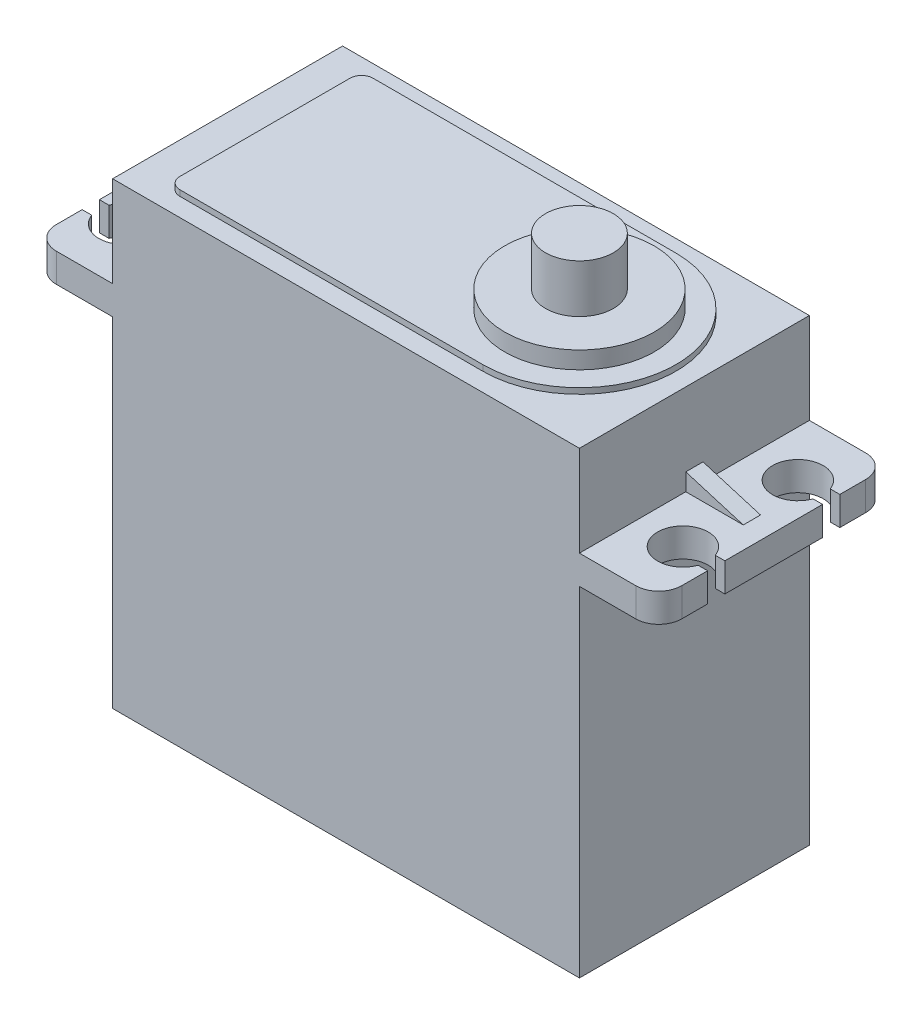
from build123d import *

# Parameters (mm, degrees)
EXTRUDE_1_DEPTH      = 10
EXTRUDE_1_DEPTH_BACK = 10
CUT_EXTRUDE_1_DEPTH  = 5
EXTRUDE_2_DEPTH      = 0.5
SKETCH_4_R           = 6.5
EXTRUDE_3_DEPTH      = 1.5
SKETCH_5_R           = 2.95
EXTRUDE_4_DEPTH      = 4.2
FILLET_1_R           = 2
EXTRUDE_5_DEPTH      = 0.75


with BuildPart() as part:
    # 草图1 → 凸台-拉伸1 (new, two sides: drawn at the far end of the back side and taken through both)
    with BuildSketch(Plane.XY.offset(-EXTRUDE_1_DEPTH_BACK)):
        Polygon((-20.3, 19.95), (20.3, 19.95), (20.3, 12.05), (27.2, 12.05), (27.2, 9.55), (20.3, 9.55), (20.3, -19.95), (-20.3, -19.95), (-20.3, 9.55), (-27.2, 9.55), (-27.2, 12.05), (-20.3, 12.05), align=None)
    extrude(amount=EXTRUDE_1_DEPTH + EXTRUDE_1_DEPTH_BACK)

    # 草图2 → 切除-拉伸1 (cut)
    with BuildSketch(Plane(origin=(0, 12.05, 0), x_dir=(1, 0, 0), z_dir=(0, 1, 0))):
        with BuildLine():
            Line((26.368211788, 4.25), (29.350265645, 4.25))
            Line((29.350265645, 4.25), (29.350265645, 5.75))
            Line((29.350265645, 5.75), (26.368211788, 5.75))
            ThreePointArc((26.368211788, 5.75), (22.1, 5), (26.368211788, 4.25))
        make_face()
        with BuildLine():
            Line((26.368211788, -4.25), (29.350265645, -4.25))
            Line((29.350265645, -4.25), (29.350265645, -5.75))
            Line((29.350265645, -5.75), (26.368211788, -5.75))
            ThreePointArc((26.368211788, -5.75), (22.1, -5), (26.368211788, -4.25))
        make_face()
        with BuildLine():
            Line((-26.368211788, -5.75), (-29.350265645, -5.75))
            Line((-29.350265645, -5.75), (-29.350265645, -4.25))
            Line((-29.350265645, -4.25), (-26.368211788, -4.25))
            ThreePointArc((-26.368211788, -4.25), (-22.1, -5), (-26.368211788, -5.75))
        make_face()
        with BuildLine():
            Line((-26.368211788, 4.25), (-29.350265645, 4.25))
            Line((-29.350265645, 4.25), (-29.350265645, 5.75))
            Line((-29.350265645, 5.75), (-26.368211788, 5.75))
            ThreePointArc((-26.368211788, 5.75), (-22.1, 5), (-26.368211788, 4.25))
        make_face()
    extrude(amount=-CUT_EXTRUDE_1_DEPTH, mode=Mode.SUBTRACT)

    # 草图3 → 凸台-拉伸2 (add)
    with BuildSketch(Plane(origin=(0, 19.95, 0), x_dir=(1, 0, 0), z_dir=(0, 1, 0))):
        with BuildLine():
            Line((-16.05, 8.4), (10.3, 8.4))
            ThreePointArc((10.3, 8.4), (18.7, 0), (10.3, -8.4))
            Line((10.3, -8.4), (-16.05, -8.4))
            ThreePointArc((-16.05, -8.4), (-16.757106781, -8.107106781), (-17.05, -7.4))
            Line((-17.05, -7.4), (-17.05, 7.4))
            ThreePointArc((-17.05, 7.4), (-16.757106781, 8.107106781), (-16.05, 8.4))
        make_face()
    extrude(amount=EXTRUDE_2_DEPTH)

    # 草图4 → 凸台-拉伸3 (add)
    with BuildSketch(Plane(origin=(0, 20.45, 0), x_dir=(1, 0, 0), z_dir=(0, 1, 0))):
        with Locations((10.3, 0)):
            Circle(SKETCH_4_R)
    extrude(amount=EXTRUDE_3_DEPTH)

    # 草图5 → 凸台-拉伸4 (add)
    with BuildSketch(Plane(origin=(0, 21.95, 0), x_dir=(1, 0, 0), z_dir=(0, 1, 0))):
        with Locations((10.3, 0)):
            Circle(SKETCH_5_R)
    extrude(amount=EXTRUDE_4_DEPTH)

    # 圆角1
    fillet_1_edges = [part.edges().sort_by_distance(p)[0] for p in [
        (-27.2, 10.8, 10),
        (-27.2, 10.8, -10),
        (27.2, 10.8, -10),
        (27.2, 10.8, 10),
    ]]
    fillet(fillet_1_edges, radius=FILLET_1_R)

    # 草图8 → 凸台-拉伸5 (add, symmetric)
    with BuildSketch(Plane.XY):
        Polygon((20.3, 13.55), (20.3, 12.05), (25.3, 12.05), align=None)
    extrude_5 = extrude(amount=EXTRUDE_5_DEPTH, both=True)

    # 镜向1: 凸台-拉伸5 across plane
    add(extrude_5.mirror(Plane(origin=(0, 0, 0), x_dir=(0, 0, 1), z_dir=(1, 0, 0))))


solid = part.part
